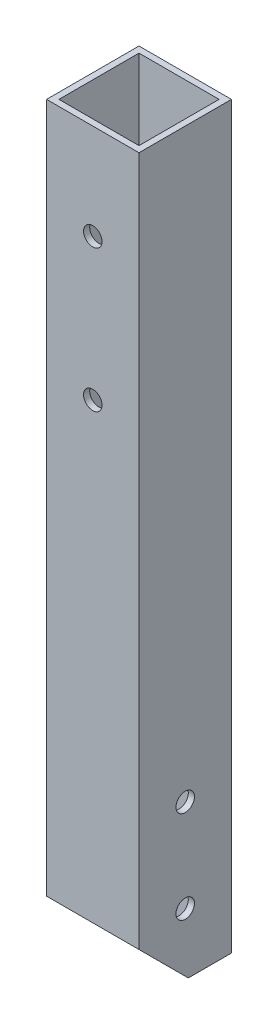
from build123d import *

# Parameters (mm, degrees)
SKETCH_1_W          = 15
SKETCH_1_H          = 15
SKETCH_1_W_2        = 13
SKETCH_1_H_2        = 13
EXTRUDE_1_DEPTH     = 120
SKETCH_2_R          = 1.5
CUT_EXTRUDE_1_DEPTH = 122.166208161
SKETCH_3_R          = 1.5
CUT_EXTRUDE_2_DEPTH = 122.166208161


with BuildPart() as part:
    # 草图1 → 凸台-拉伸1 (new body)
    with BuildSketch(Plane(origin=(0, 0, 0), x_dir=(1, 0, 0), z_dir=(0, 1, 0))):
        Rectangle(SKETCH_1_W, SKETCH_1_H)
        Rectangle(SKETCH_1_W_2, SKETCH_1_H_2, mode=Mode.SUBTRACT)
    extrude(amount=EXTRUDE_1_DEPTH)

    # 草图2 → 切除-拉伸1 (cut, through all)
    with BuildSketch(Plane.XY.offset(7.5)):
        with Locations((0, 104.5)):
            Circle(SKETCH_2_R)
        with Locations((0, 81.5)):
            Circle(SKETCH_2_R)
    extrude(amount=-CUT_EXTRUDE_1_DEPTH, mode=Mode.SUBTRACT)

    # 草图3 → 切除-拉伸2 (cut, through all)
    with BuildSketch(Plane.ZY.offset(7.5)):
        with Locations((0, 10)):
            Circle(SKETCH_3_R)
        with Locations((0, 25)):
            Circle(SKETCH_3_R)
        Polygon((-0.5, 0), (7.5, 0), (7.5, 8), align=None)
    extrude(amount=-CUT_EXTRUDE_2_DEPTH, mode=Mode.SUBTRACT)


solid = part.part
